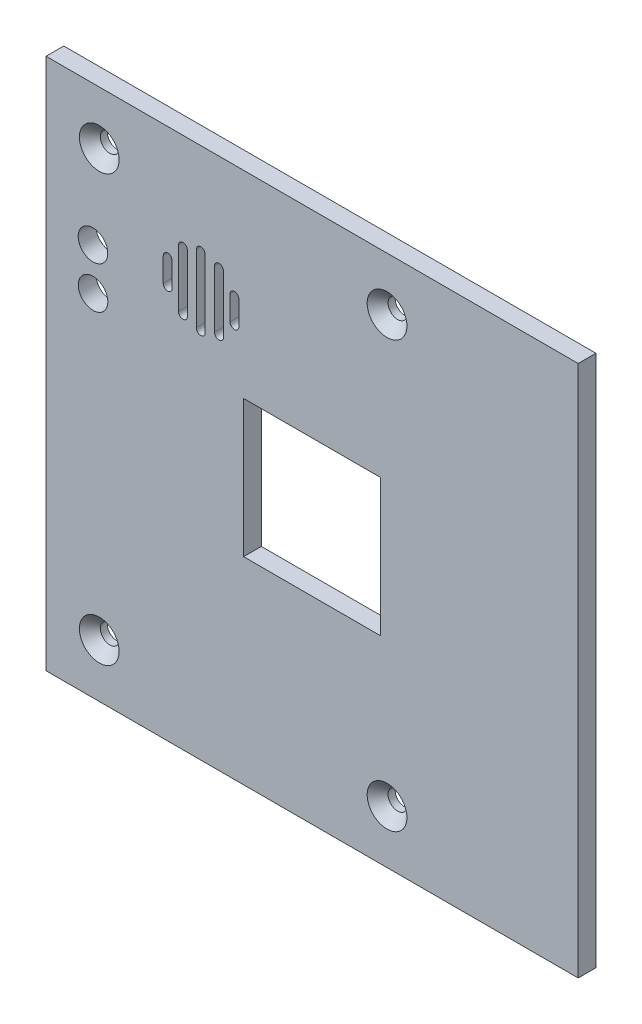
from build123d import *

# Parameters (mm, degrees)
CROQUIS1_W                      = 90
CROQUIS1_H                      = 90
CROQUIS1_R                      = 2.5
CROQUIS1_R_2                    = 1.625
CROQUIS1_W_2                    = 23.18
CROQUIS1_H_2                    = 23.18
SALIENTE_EXTRUIR1_DEPTH         = 3
CROQUIS2_R                      = 3.35997123
CORTAR_EXTRUIR1_DEPTH           = 1.8
CORTAR_EXTRUIR1_DRAFT           = -44
CORTAR_EXTRUIR1_PROFILE_2_DEPTH = 1.8
CORTAR_EXTRUIR1_PROFILE_2_DRAFT = -44
CORTAR_EXTRUIR1_PROFILE_3_DEPTH = 1.8
CORTAR_EXTRUIR1_PROFILE_3_DRAFT = -44
CORTAR_EXTRUIR1_PROFILE_4_DEPTH = 1.8
CORTAR_EXTRUIR1_PROFILE_4_DRAFT = -44


with BuildPart() as part:
    # Croquis1 → Saliente-Extruir1 (new body)
    with BuildSketch(Plane.XY):
        with Locations((6.790535393, -1.76108936)):
            Rectangle(CROQUIS1_W, CROQUIS1_H)
        with Locations((-30.272299079, 19.584790813)):
            Circle(CROQUIS1_R, mode=Mode.SUBTRACT)
        with Locations((-30.262724761, 12.486512925)):
            Circle(CROQUIS1_R, mode=Mode.SUBTRACT)
        with Locations((-29.209464607, 34.23891064)):
            Circle(CROQUIS1_R_2, mode=Mode.SUBTRACT)
        with Locations((19.459089133, 34.23891064)):
            Circle(CROQUIS1_R_2, mode=Mode.SUBTRACT)
        with Locations((-29.209464607, -37.76108936)):
            Circle(CROQUIS1_R_2, mode=Mode.SUBTRACT)
        with Locations((19.459089133, -37.76108936)):
            Circle(CROQUIS1_R_2, mode=Mode.SUBTRACT)
        with Locations((6.790535393, -1.76108936)):
            Rectangle(CROQUIS1_W_2, CROQUIS1_H_2, mode=Mode.SUBTRACT)
        with BuildLine():
            Line((-11.293405686, 27.67391064), (-11.293405686, 16.17391064))
            ThreePointArc((-11.293405686, 16.17391064), (-12.043405686, 15.42391064), (-12.793405686, 16.17391064))
            Line((-12.793405686, 16.17391064), (-12.793405686, 27.67391064))
            ThreePointArc((-12.793405686, 27.67391064), (-12.043405686, 28.42391064), (-11.293405686, 27.67391064))
        make_face(mode=Mode.SUBTRACT)
        with BuildLine():
            Line((-14.308998248, 26.794100575), (-14.308998248, 17.053720706))
            ThreePointArc((-14.308998248, 17.053720706), (-15.058998248, 16.303720706), (-15.808998248, 17.053720706))
            Line((-15.808998248, 17.053720706), (-15.808998248, 26.794100575))
            ThreePointArc((-15.808998248, 26.794100575), (-15.058998248, 27.544100575), (-14.308998248, 26.794100575))
        make_face(mode=Mode.SUBTRACT)
        with BuildLine():
            Line((-8.210041057, 26.794100575), (-8.210041057, 17.053720706))
            ThreePointArc((-8.210041057, 17.053720706), (-8.960041057, 16.303720706), (-9.710041057, 17.053720706))
            Line((-9.710041057, 17.053720706), (-9.710041057, 26.794100575))
            ThreePointArc((-9.710041057, 26.794100575), (-8.960041057, 27.544100575), (-8.210041057, 26.794100575))
        make_face(mode=Mode.SUBTRACT)
        with BuildLine():
            Line((-16.889510612, 23.96392892), (-16.889510612, 19.883892361))
            ThreePointArc((-16.889510612, 19.883892361), (-17.639510612, 19.133892361), (-18.389510612, 19.883892361))
            Line((-18.389510612, 19.883892361), (-18.389510612, 23.96392892))
            ThreePointArc((-18.389510612, 23.96392892), (-17.639510612, 24.71392892), (-16.889510612, 23.96392892))
        make_face(mode=Mode.SUBTRACT)
        with BuildLine():
            Line((-5.604418602, 23.96392892), (-5.604418602, 19.883892361))
            ThreePointArc((-5.604418602, 19.883892361), (-6.354418602, 19.133892361), (-7.104418602, 19.883892361))
            Line((-7.104418602, 19.883892361), (-7.104418602, 23.96392892))
            ThreePointArc((-7.104418602, 23.96392892), (-6.354418602, 24.71392892), (-5.604418602, 23.96392892))
        make_face(mode=Mode.SUBTRACT)
    extrude(amount=SALIENTE_EXTRUIR1_DEPTH)


with BuildPart() as cortar_extruir1_tool:
    # Croquis2 → Cortar-Extruir1 (with draft: the straight prism first)
    with BuildSketch(Plane.XY.offset(3)):
        with Locations((-29.209464607, 34.23891064)):
            Circle(CROQUIS2_R)
    extrude(amount=-CORTAR_EXTRUIR1_DEPTH)
    # Cortar-Extruir1: the draft: its side faces are tilted about the plane it starts from
    cortar_extruir1_sides = [cortar_extruir1_tool.faces().sort_by_distance(p)[0] for p in [
        (-32.569435837, 34.23891064, 2.1),
    ]]
    draft(cortar_extruir1_sides, Plane.XY.offset(3), CORTAR_EXTRUIR1_DRAFT)


with BuildPart() as part_1:
    add(part.part)

    # Cortar-Extruir1: cut by cortar_extruir1_tool
    add(cortar_extruir1_tool.part, mode=Mode.SUBTRACT)


with BuildPart() as cortar_extruir1_profile_2_tool:
    # Croquis2 → Cortar-Extruir1 profile 2 (with draft: the straight prism first)
    with BuildSketch(Plane.XY.offset(3)):
        with Locations((19.459089133, 34.23891064)):
            Circle(CROQUIS2_R)
    extrude(amount=-CORTAR_EXTRUIR1_PROFILE_2_DEPTH)
    # Cortar-Extruir1 profile 2: the draft: its side faces are tilted about the plane it starts from
    cortar_extruir1_profile_2_sides = [cortar_extruir1_profile_2_tool.faces().sort_by_distance(p)[0] for p in [
        (16.099117903, 34.23891064, 2.1),
    ]]
    draft(cortar_extruir1_profile_2_sides, Plane.XY.offset(3), CORTAR_EXTRUIR1_PROFILE_2_DRAFT)


with BuildPart() as part_2:
    add(part_1.part)

    # Cortar-Extruir1 profile 2: cut by cortar_extruir1_profile_2_tool
    add(cortar_extruir1_profile_2_tool.part, mode=Mode.SUBTRACT)


with BuildPart() as cortar_extruir1_profile_3_tool:
    # Croquis2 → Cortar-Extruir1 profile 3 (with draft: the straight prism first)
    with BuildSketch(Plane.XY.offset(3)):
        with Locations((19.459089133, -37.76108936)):
            Circle(CROQUIS2_R)
    extrude(amount=-CORTAR_EXTRUIR1_PROFILE_3_DEPTH)
    # Cortar-Extruir1 profile 3: the draft: its side faces are tilted about the plane it starts from
    cortar_extruir1_profile_3_sides = [cortar_extruir1_profile_3_tool.faces().sort_by_distance(p)[0] for p in [
        (16.099117903, -37.76108936, 2.1),
    ]]
    draft(cortar_extruir1_profile_3_sides, Plane.XY.offset(3), CORTAR_EXTRUIR1_PROFILE_3_DRAFT)


with BuildPart() as part_3:
    add(part_2.part)

    # Cortar-Extruir1 profile 3: cut by cortar_extruir1_profile_3_tool
    add(cortar_extruir1_profile_3_tool.part, mode=Mode.SUBTRACT)


with BuildPart() as cortar_extruir1_profile_4_tool:
    # Croquis2 → Cortar-Extruir1 profile 4 (with draft: the straight prism first)
    with BuildSketch(Plane.XY.offset(3)):
        with Locations((-29.209464607, -37.76108936)):
            Circle(CROQUIS2_R)
    extrude(amount=-CORTAR_EXTRUIR1_PROFILE_4_DEPTH)
    # Cortar-Extruir1 profile 4: the draft: its side faces are tilted about the plane it starts from
    cortar_extruir1_profile_4_sides = [cortar_extruir1_profile_4_tool.faces().sort_by_distance(p)[0] for p in [
        (-32.569435837, -37.76108936, 2.1),
    ]]
    draft(cortar_extruir1_profile_4_sides, Plane.XY.offset(3), CORTAR_EXTRUIR1_PROFILE_4_DRAFT)


with BuildPart() as part_4:
    add(part_3.part)

    # Cortar-Extruir1 profile 4: cut by cortar_extruir1_profile_4_tool
    add(cortar_extruir1_profile_4_tool.part, mode=Mode.SUBTRACT)


solid = part_4.part
